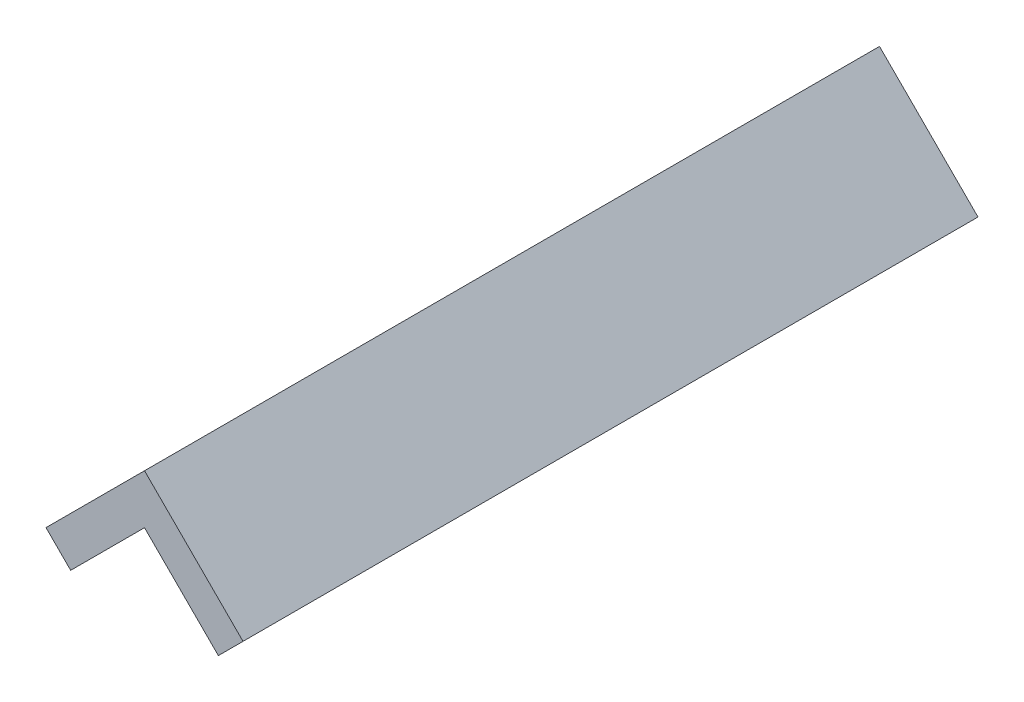
from build123d import *

# Parameters (mm, degrees)
RESSALTO_EXTRUS_O1_DEPTH = 67


with BuildPart() as part:
    # Esboço1 → Ressalto-extrusão1 (new body)
    with BuildSketch(Plane.XY):
        Polygon((8.980256121, 8.980256121), (17.960512242, 0), (15.711912678, -2.248599564), (8.980256121, 4.483056993), (2.248599564, -2.248599564), (0, 0), align=None)
    extrude(amount=RESSALTO_EXTRUS_O1_DEPTH)


solid = part.part
